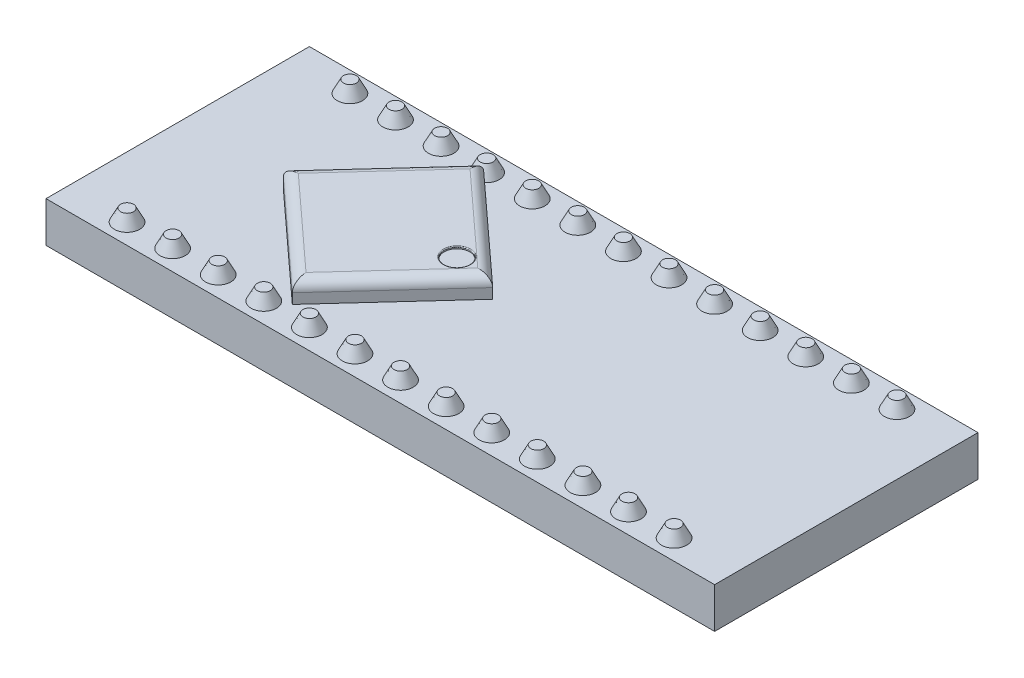
from build123d import *

# Parameters (mm, degrees)
SKETCH1_W           = 33
SKETCH1_H           = 13
BOSS_EXTRUDE1_DEPTH = 2
BOSS_EXTRUDE2_DEPTH = 1
FILLET1_R           = 0.5
SKETCH3_R           = 0.631168426
CUT_EXTRUDE1_DEPTH  = 0.1
FILLET2_R           = 0.04
SKETCH4_R           = 0.625
BOSS_EXTRUDE3_DEPTH = 0.6
BOSS_EXTRUDE3_TAPER = 27


with BuildPart() as part:
    # Sketch1 → Boss-Extrude1 (new body)
    with BuildSketch(Plane(origin=(0, 0, 0), x_dir=(1, 0, 0), z_dir=(0, 1, 0))):
        Rectangle(SKETCH1_W, SKETCH1_H)
    extrude(amount=BOSS_EXTRUDE1_DEPTH)

    # Sketch2 → Boss-Extrude2 (add)
    with BuildSketch(Plane(origin=(0, 2, 0), x_dir=(1, 0, 0), z_dir=(0, 1, 0))):
        Polygon((-11.063698409, -0.221797323), (-5.897125464, -4.944775622), (-1.174147166, 0.221797323), (-6.340720111, 4.944775622), align=None)
    extrude(amount=BOSS_EXTRUDE2_DEPTH)

    # Fillet1
    fillet1_edges = [part.edges().sort_by_distance(p)[0] for p in [
        (-8.70220926, 3, -2.361489149),
        (-8.480411937, 3, 2.583286472),
        (-3.535636315, 3, 2.361489149),
        (-3.757433638, 3, -2.583286472),
    ]]
    fillet(fillet1_edges, radius=FILLET1_R)

    # Sketch3 → Cut-Extrude1 (cut)
    with BuildSketch(Plane(origin=(0, 3, 0), x_dir=(1, 0, 0), z_dir=(0, 1, 0))):
        with Locations(Location((-2.868853152, 0.151489879, 0), (0, 0, 270))):
            Circle(SKETCH3_R)
    extrude(amount=-CUT_EXTRUDE1_DEPTH, mode=Mode.SUBTRACT)

    # Fillet2
    fillet2_edges = [part.edges().sort_by_distance(p)[0] for p in [
        (-2.868853152, 3, -0.782658305),
    ]]
    fillet(fillet2_edges, radius=FILLET2_R)

    # Sketch4 → Boss-Extrude3 (add)
    with BuildSketch(Plane(origin=(0, 2, 0), x_dir=(1, 0, 0), z_dir=(0, 1, 0))):
        with Locations((-13.5, 5.5)):
            Circle(SKETCH4_R)
        with Locations((-11.25, 5.5)):
            Circle(SKETCH4_R)
        with Locations((-9, 5.5)):
            Circle(SKETCH4_R)
        with Locations((-6.75, 5.5)):
            Circle(SKETCH4_R)
        with Locations((-4.5, 5.5)):
            Circle(SKETCH4_R)
        with Locations((-2.25, 5.5)):
            Circle(SKETCH4_R)
        with Locations((0, 5.5)):
            Circle(SKETCH4_R)
        with Locations((2.25, 5.5)):
            Circle(SKETCH4_R)
        with Locations((4.5, 5.5)):
            Circle(SKETCH4_R)
        with Locations((6.75, 5.5)):
            Circle(SKETCH4_R)
        with Locations((9, 5.5)):
            Circle(SKETCH4_R)
        with Locations((11.25, 5.5)):
            Circle(SKETCH4_R)
        with Locations((13.5, 5.5)):
            Circle(SKETCH4_R)
        with Locations((-13.5, -5.5)):
            Circle(SKETCH4_R)
        with Locations((-11.25, -5.5)):
            Circle(SKETCH4_R)
        with Locations((-9, -5.5)):
            Circle(SKETCH4_R)
        with Locations((-6.75, -5.5)):
            Circle(SKETCH4_R)
        with Locations((-4.5, -5.5)):
            Circle(SKETCH4_R)
        with Locations((-2.25, -5.5)):
            Circle(SKETCH4_R)
        with Locations((0, -5.5)):
            Circle(SKETCH4_R)
        with Locations((2.25, -5.5)):
            Circle(SKETCH4_R)
        with Locations((4.5, -5.5)):
            Circle(SKETCH4_R)
        with Locations((6.75, -5.5)):
            Circle(SKETCH4_R)
        with Locations((9, -5.5)):
            Circle(SKETCH4_R)
        with Locations((11.25, -5.5)):
            Circle(SKETCH4_R)
        with Locations((13.5, -5.5)):
            Circle(SKETCH4_R)
    extrude(amount=BOSS_EXTRUDE3_DEPTH, taper=BOSS_EXTRUDE3_TAPER)


solid = part.part
